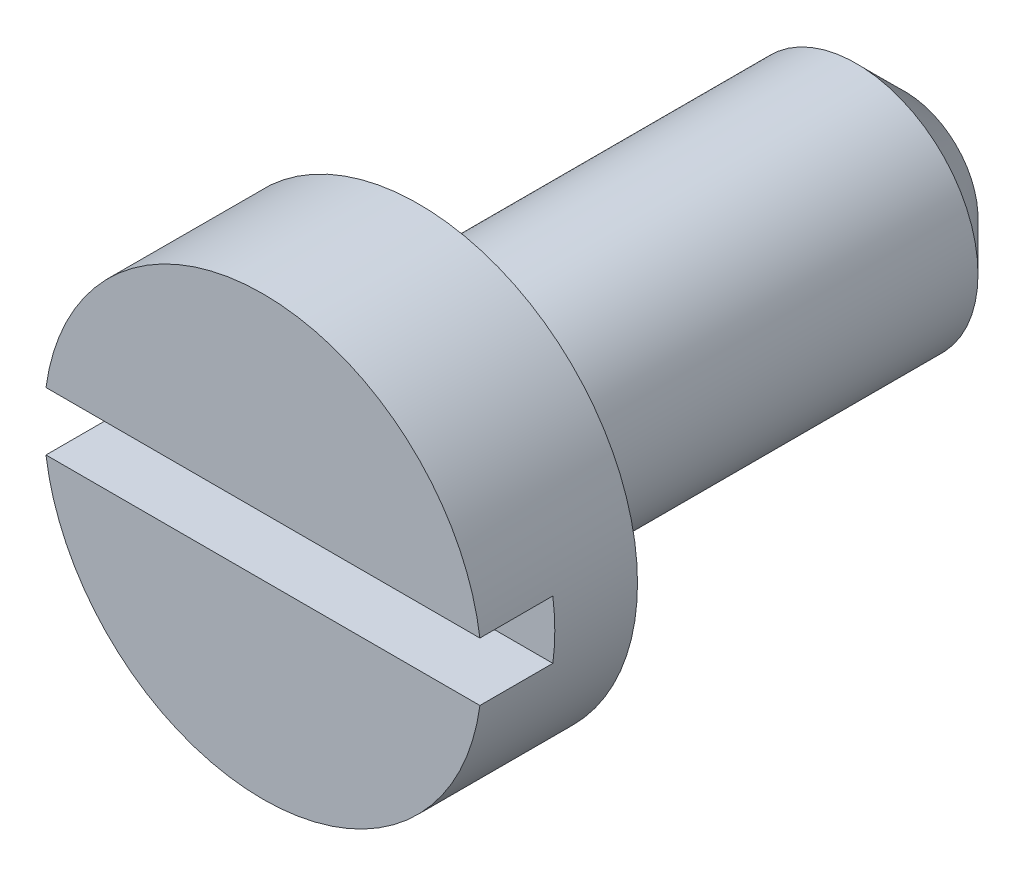
from build123d import *

# Parameters (mm, degrees)
SKETCH_12_R         = 2.25
EXTRUDE_3_DEPTH     = 1.6
SKETCH_13_R         = 1.25
EXTRUDE_4_DEPTH     = 5
SKETCH_20_W         = 5.3767507
SKETCH_20_H         = 0.6
CUT_EXTRUDE_8_DEPTH = 0.75
CHAMFER_1_SIZE      = 0.5


with BuildPart() as part:
    # Эскиз12 → Вытянуть3 (new body)
    with BuildSketch(Plane.XY):
        Circle(SKETCH_12_R)
    extrude(amount=EXTRUDE_3_DEPTH)

    # Эскиз13 → Вытянуть4 (add)
    with BuildSketch(Plane(origin=(0, 0, 0), x_dir=(-1, 0, 0), z_dir=(0, 0, -1))):
        with Locations(Location((0, 0, 0), (0, 0, 180))):
            Circle(SKETCH_13_R)
    extrude(amount=EXTRUDE_4_DEPTH)

    # Эскиз20 → Вырез-Вытянуть8 (cut)
    with BuildSketch(Plane.XY.offset(1.6)):
        with Locations((0.019257703, 0)):
            Rectangle(SKETCH_20_W, SKETCH_20_H)
    extrude(amount=-CUT_EXTRUDE_8_DEPTH, mode=Mode.SUBTRACT)

    # Фаска1
    chamfer_1_edges = [part.edges().sort_by_distance(p)[0] for p in [
        (-1.25, 0, -5),
    ]]
    chamfer(chamfer_1_edges, length=CHAMFER_1_SIZE)


solid = part.part
